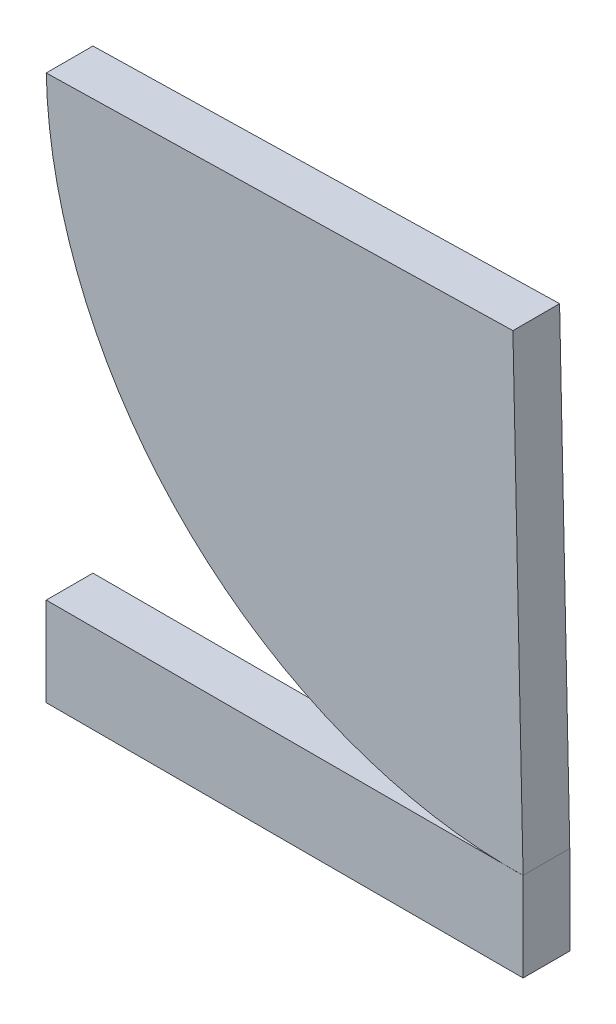
from build123d import *

# Parameters (mm, degrees)
EXTRUDE_1_DEPTH   = 1
EXTRUDE_1_2_DEPTH = 1


with BuildPart() as part:
    # ｽｹｯﾁ1 → ﾎﾞｽ - 押し出し1 (new body)
    with BuildSketch(Plane.XY):
        with BuildLine():
            Line((0, 0), (-9.997621528, -0.218091207))
            ThreePointArc((-9.997621528, -0.218091207), (-7.071067812, -7.071067812), (-0.218091207, -9.997621528))
            Line((-0.218091207, -9.997621528), (0.218091207, -9.997621528))
            Line((0.218091207, -9.997621528), (0, 0))
        make_face()
    extrude(amount=EXTRUDE_1_DEPTH)


with BuildPart() as body_2:
    # ｽｹｯﾁ1 → Extrude 1 2 (new body)
    with BuildSketch(Plane.XY):
        with BuildLine():
            ThreePointArc((0.218091207, -9.997621528), (0, -10), (-0.218091207, -9.997621528))
            Line((-0.218091207, -9.997621528), (-9.997621528, -9.997621528))
            Line((-9.997621528, -9.997621528), (-9.997621528, -11.901425508))
            Line((-9.997621528, -11.901425508), (0.218091207, -11.901425508))
            Line((0.218091207, -11.901425508), (0.218091207, -9.997621528))
        make_face()
    extrude(amount=EXTRUDE_1_2_DEPTH)


solid = Compound([part.part, body_2.part])
